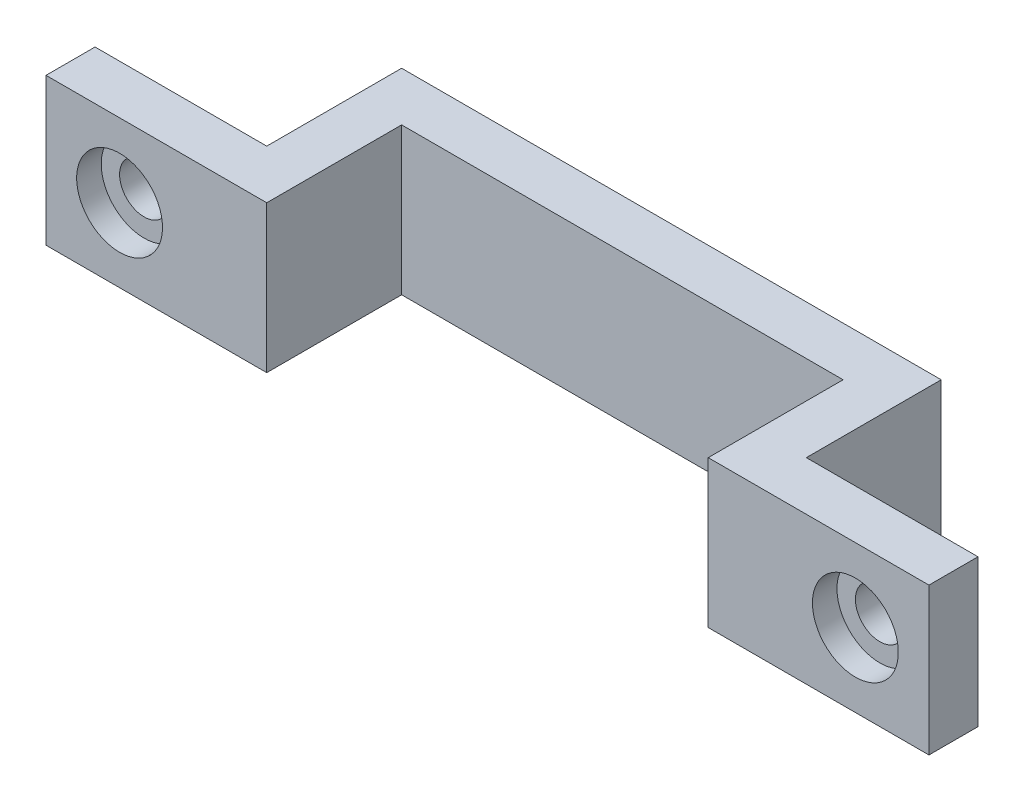
from build123d import *

# Parameters (mm, degrees)
SKICA1_W                 = 72
SKICA1_H                 = 12
SKICA1_R                 = 2
P_IDAT_VYSUNUT_M1_DEPTH  = 4
SKICA2_R                 = 3.5
ODEBRAT_VYSUNUT_M1_DEPTH = 2
SKICA3_W                 = 44
SKICA3_H                 = 12
P_IDAT_VYSUNUT_M2_DEPTH  = 11
SKICA4_W                 = 36
SKICA4_H                 = 12
ODEBRAT_VYSUNUT_M2_DEPTH = 11


with BuildPart() as part:
    # Skica1 → Přidat vysunutím1 (new body)
    with BuildSketch(Plane.XY):
        Rectangle(SKICA1_W, SKICA1_H)
        with Locations((-30, 0)):
            Circle(SKICA1_R, mode=Mode.SUBTRACT)
        with Locations(Location((30, 0, 0), (0, 0, 180))):
            Circle(SKICA1_R, mode=Mode.SUBTRACT)
    extrude(amount=P_IDAT_VYSUNUT_M1_DEPTH)

    # Skica2 → Odebrat vysunutím1 (cut)
    with BuildSketch(Plane.XY.offset(4)):
        with Locations((-30, 0)):
            Circle(SKICA2_R)
        with Locations(Location((30, 0, 0), (0, 0, 180))):
            Circle(SKICA2_R)
    extrude(amount=-ODEBRAT_VYSUNUT_M1_DEPTH, mode=Mode.SUBTRACT)

    # Skica3 → Přidat vysunutím2 (add)
    with BuildSketch(Plane(origin=(0, 0, 0), x_dir=(-1, 0, 0), z_dir=(0, 0, -1))):
        Rectangle(SKICA3_W, SKICA3_H)
    extrude(amount=P_IDAT_VYSUNUT_M2_DEPTH)

    # Skica4 → Odebrat vysunutím2 (cut)
    with BuildSketch(Plane.XY.offset(4)):
        Rectangle(SKICA4_W, SKICA4_H)
    extrude(amount=-ODEBRAT_VYSUNUT_M2_DEPTH, mode=Mode.SUBTRACT)


solid = part.part
